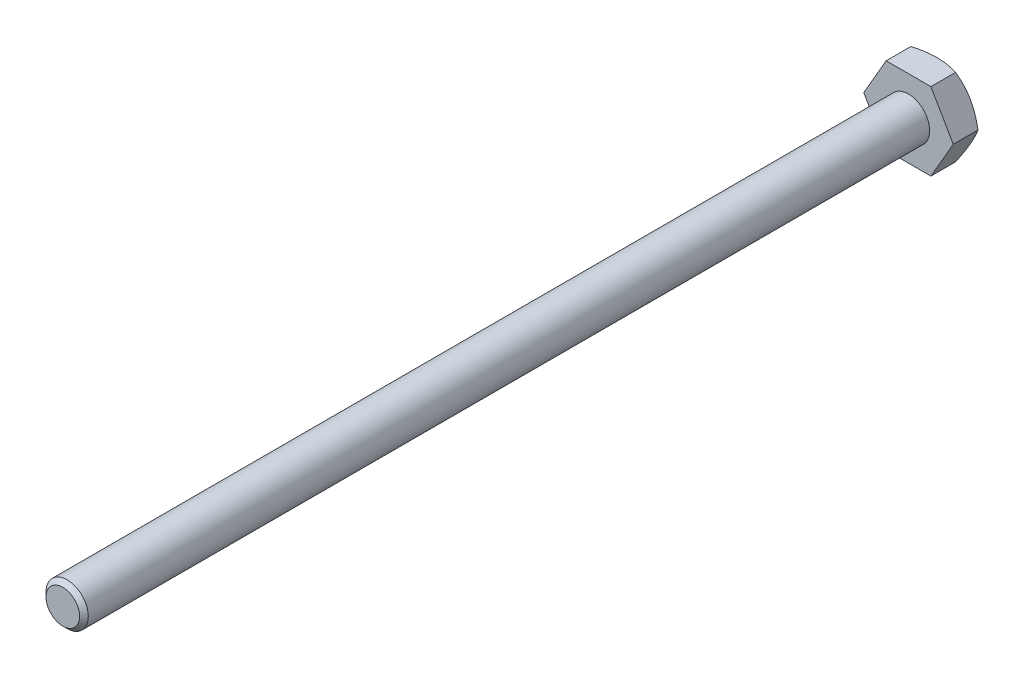
from build123d import *

# Parameters (mm, degrees)
EXTRUDE1_DEPTH = 2
SKETCH2_R      = 1.5
EXTRUDE2_DEPTH = 60
CHAMFER1_SIZE  = 0.307


with BuildPart() as part:
    # Sketch1 → Extrude1 (new body)
    with BuildSketch(Plane.XY):
        Polygon((3.175426481, 0), (1.58771324, 2.75), (-1.58771324, 2.75), (-3.175426481, 0), (-1.58771324, -2.75), (1.58771324, -2.75), align=None)
    extrude(amount=EXTRUDE1_DEPTH)

    # Sketch2 → Extrude2 (add)
    with BuildSketch(Plane.XY.offset(2)):
        Circle(SKETCH2_R)
    extrude(amount=EXTRUDE2_DEPTH)

    # Sketch3 → Cut-Revolve1 (revolve, cut)
    with BuildSketch(Plane(origin=(0, 0, 0), x_dir=(0, 0, -1), z_dir=(1, 0, 0))):
        Polygon((0, 2.75), (0, 102.75), (-57.735026919, 102.75), align=None)
    revolve(axis=Axis((0, 0, 0), (0, 0, -1)), mode=Mode.SUBTRACT)

    # Chamfer1
    chamfer1_edges = [part.edges().sort_by_distance(p)[0] for p in [
        (-1.5, 0, 62),
    ]]
    chamfer(chamfer1_edges, length=CHAMFER1_SIZE)


solid = part.part
